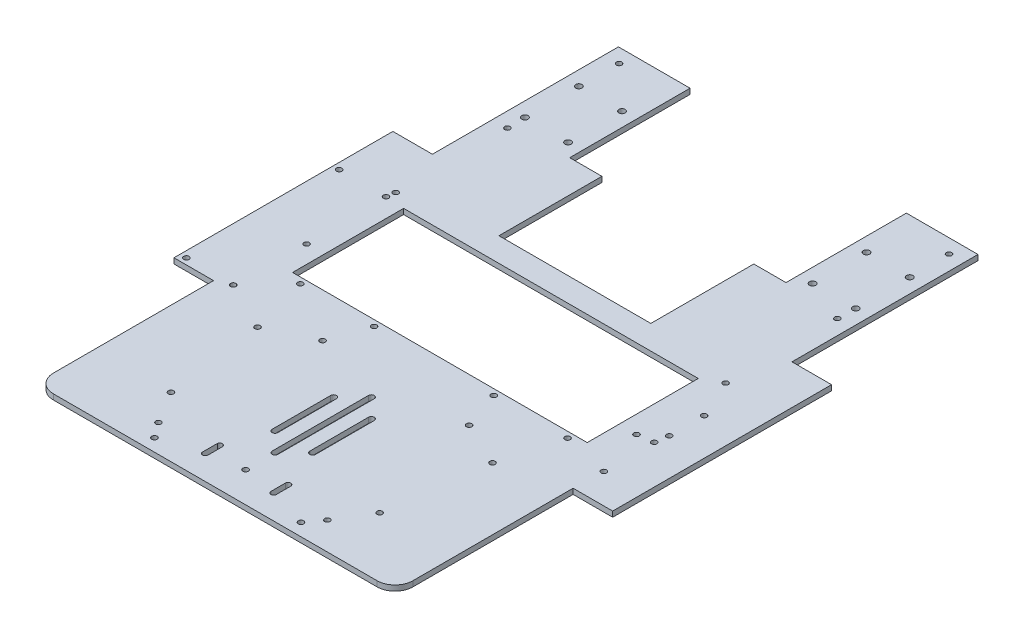
from build123d import *

# Parameters (mm, degrees)
SKETCH_1_W           = 200
SKETCH_1_H           = 375
EXTRUDE_1_DEPTH      = 3
SKETCH_2_R           = 1.75
CUT_EXTRUDE_1_DEPTH  = 10
SKETCH_3_R           = 1.5
CUT_EXTRUDE_2_DEPTH  = 10
SKETCH_4_R           = 1.5
CUT_EXTRUDE_3_DEPTH  = 10
SKETCH_5_W           = 210
SKETCH_5_H           = 50.72585274
CUT_EXTRUDE_5_DEPTH  = 34.39
SKETCH_8_R           = 1.5
EXTRUDE_2_DEPTH      = 3
SKETCH_9_W           = 163.883016164
SKETCH_9_H           = 75
CUT_EXTRUDE_6_DEPTH  = 10
CUT_EXTRUDE_7_DEPTH  = 3
SKETCH_11_R          = 1.5
CUT_EXTRUDE_8_DEPTH  = 6
SKETCH_12_R          = 1.5
CUT_EXTRUDE_9_DEPTH  = 3
CUT_EXTRUDE_10_DEPTH = 163.8
SKETCH_16_W          = 173.87129554
SKETCH_16_H          = 50.701400684
EXTRUDE_4_DEPTH      = 3
SKETCH_18_W          = 121.748470969
SKETCH_18_H          = 3
EXTRUDE_5_DEPTH      = 22
SKETCH_19_W          = 17.27862471
SKETCH_19_H          = 21.556396233
CUT_EXTRUDE_11_DEPTH = 22
SKETCH_20_R          = 1.5
CUT_EXTRUDE_12_DEPTH = 5
SKETCH_21_R          = 1.5
CUT_EXTRUDE_13_DEPTH = 6
SKETCH_22_W          = 163.883016164
SKETCH_22_H          = 4.895548477
EXTRUDE_6_DEPTH      = 3
CUT_EXTRUDE_14_DEPTH = 10
CUT_EXTRUDE_15_DEPTH = 10
SKETCH_25_R          = 1.5
CUT_EXTRUDE_16_DEPTH = 5
SKETCH_26_R          = 1.5
CUT_EXTRUDE_17_DEPTH = 10
SKETCH_27_R          = 1.5
CUT_EXTRUDE_18_DEPTH = 3
SKETCH_28_R          = 1.5
CUT_EXTRUDE_19_DEPTH = 3
FILLET_1_R           = 10


with BuildPart() as part:
    # 草图1 → 凸台-拉伸1 (new body)
    with BuildSketch(Plane(origin=(0, 0, 0), x_dir=(1, 0, 0), z_dir=(0, 1, 0))):
        Rectangle(SKETCH_1_W, SKETCH_1_H)
    extrude(amount=EXTRUDE_1_DEPTH)

    # 草图2 → 切除-拉伸1 (cut)
    with BuildSketch(Plane.XZ):
        with Locations(Location((-68, -157.5, 0), (0, 0, 270))):
            Circle(SKETCH_2_R)
        with Locations(Location((-92, -157.5, 0), (0, 0, 270))):
            Circle(SKETCH_2_R)
        with Locations(Location((-92, -127.5, 0), (0, 0, 270))):
            Circle(SKETCH_2_R)
        with Locations(Location((-68, -127.5, 0), (0, 0, 270))):
            Circle(SKETCH_2_R)
        with Locations(Location((68, -157.5, 0), (0, 0, 270))):
            Circle(SKETCH_2_R)
        with Locations(Location((92, -157.5, 0), (0, 0, 270))):
            Circle(SKETCH_2_R)
        with Locations(Location((92, -127.5, 0), (0, 0, 270))):
            Circle(SKETCH_2_R)
        with Locations(Location((68, -127.5, 0), (0, 0, 270))):
            Circle(SKETCH_2_R)
    extrude(amount=-CUT_EXTRUDE_1_DEPTH, mode=Mode.SUBTRACT)

    # 草图3 → 切除-拉伸2 (cut)
    with BuildSketch(Plane(origin=(0, 3, 0), x_dir=(1, 0, 0), z_dir=(0, 1, 0))):
        with Locations(Location((0, -119.896683452, 0), (0, 0, 270))):
            Circle(SKETCH_3_R)
    extrude(amount=-CUT_EXTRUDE_2_DEPTH, mode=Mode.SUBTRACT)

    # 草图4 → 切除-拉伸3 (cut)
    with BuildSketch(Plane(origin=(0, 3, 0), x_dir=(1, 0, 0), z_dir=(0, 1, 0))):
        with Locations(Location((19, -119.896683452, 0), (0, 0, 270))):
            Circle(SKETCH_4_R)
        with Locations(Location((-19, -119.896683452, 0), (0, 0, 270))):
            Circle(SKETCH_4_R)
    extrude(amount=-CUT_EXTRUDE_3_DEPTH, mode=Mode.SUBTRACT)

    # 草图5 → 切除-拉伸5 (cut)
    with BuildSketch(Plane.XZ):
        with Locations((0, 162.13707363)):
            Rectangle(SKETCH_5_W, SKETCH_5_H)
    extrude(amount=-CUT_EXTRUDE_5_DEPTH, mode=Mode.SUBTRACT)

    # 草图8 → 凸台-拉伸2 (add)
    with BuildSketch(Plane.ZY.offset(100)):
        with BuildLine():
            Line((34.419687156, 14.367900616), (37.872189, 3))
            Line((37.872189, 3), (25.226116951, 3))
            Line((25.226116951, 3), (28.678618796, 14.367900616))
            ThreePointArc((28.678618796, 14.367900616), (31.549152976, 16.496101602), (34.419687156, 14.367900616))
        make_face()
        with Locations((31.549152976, 13.496101602)):
            Circle(SKETCH_8_R, mode=Mode.SUBTRACT)
    extrude(amount=-EXTRUDE_2_DEPTH)

    # 草图9 → 切除-拉伸6 (cut)
    with BuildSketch(Plane.XZ):
        with Locations((0, 18.152093794)):
            Rectangle(SKETCH_9_W, SKETCH_9_H)
    extrude(amount=-CUT_EXTRUDE_6_DEPTH, mode=Mode.SUBTRACT)

    # 草图10 → 切除-拉伸7 (cut)
    with BuildSketch(Plane.XZ):
        Polygon((-60.157077223, -120.5533384), (-42.238826625, -120.5533384), (-42.238826625, -63.289088645), (42.238826625, -63.289088645), (42.238826625, -120.5533384), (60.157077223, -120.5533384), (60.157077223, -187.5), (-60.157077223, -187.5), align=None)
    extrude(amount=-CUT_EXTRUDE_7_DEPTH, mode=Mode.SUBTRACT)

    # 草图11 → 切除-拉伸8 (cut)
    with BuildSketch(Plane(origin=(0, 3, 0), x_dir=(1, 0, 0), z_dir=(0, 1, 0))):
        with Locations(Location((-91.756220162, 179.630143817, 0), (0, 0, 270))):
            Circle(SKETCH_11_R)
        with Locations(Location((-91.756220162, 117.5, 0), (0, 0, 270))):
            Circle(SKETCH_11_R)
        with Locations(Location((-91.756220162, 55.369856183, 0), (0, 0, 270))):
            Circle(SKETCH_11_R)
        with Locations(Location((91.756220162, 55.369856183, 0), (0, 0, 270))):
            Circle(SKETCH_11_R)
        with Locations(Location((91.756220162, 117.5, 0), (0, 0, 270))):
            Circle(SKETCH_11_R)
        with Locations(Location((91.756220162, 179.630143817, 0), (0, 0, 270))):
            Circle(SKETCH_11_R)
    extrude(amount=-CUT_EXTRUDE_8_DEPTH, mode=Mode.SUBTRACT)

    # 草图12 → 切除-拉伸9 (cut)
    with BuildSketch(Plane(origin=(0, 3, 0), x_dir=(1, 0, 0), z_dir=(0, 1, 0))):
        with Locations(Location((-91.756220162, 5.808361465, 0), (0, 0, 270))):
            Circle(SKETCH_12_R)
        with Locations(Location((91.756220162, 5.808361465, 0), (0, 0, 270))):
            Circle(SKETCH_12_R)
    extrude(amount=-CUT_EXTRUDE_9_DEPTH, mode=Mode.SUBTRACT)

    # 草图14 → 切除-拉伸10 (cut)
    with BuildSketch(Plane(origin=(0, 3, 0), x_dir=(1, 0, 0), z_dir=(0, 1, 0))):
        Polygon((81.941508082, 19.347906206), (81.941508082, 49.288971574), (81.941508082, 54.851401937), (-81.941508082, 54.851401937), (-81.941508082, 49.288971574), (-81.941508082, 19.347906206), align=None)
    extrude(amount=-CUT_EXTRUDE_10_DEPTH, mode=Mode.SUBTRACT)

    # 草图16 → 凸台-拉伸4 (add)
    with BuildSketch(Plane(origin=(0, 3, 0), x_dir=(1, 0, 0), z_dir=(0, 1, 0))):
        with Locations((0.567640728, -37.155553542)):
            Rectangle(SKETCH_16_W, SKETCH_16_H)
    extrude(amount=-EXTRUDE_4_DEPTH)

    # 草图18 → 凸台-拉伸5 (add)
    with BuildSketch(Plane.ZY.offset(100)):
        with Locations((-23.168262452, 1.5)):
            Rectangle(SKETCH_18_W, SKETCH_18_H)
    extrude_5 = extrude(amount=EXTRUDE_5_DEPTH)

    # 草图19 → 切除-拉伸11 (cut)
    with BuildSketch(Plane.ZY.offset(100)):
        with Locations((31.606580178, 13.778198117)):
            Rectangle(SKETCH_19_W, SKETCH_19_H)
    extrude(amount=-CUT_EXTRUDE_11_DEPTH, mode=Mode.SUBTRACT)

    # 镜向1: 凸台-拉伸5 across plane
    add(extrude_5.mirror(Plane(origin=(0, 0, 0), x_dir=(0, 0, 1), z_dir=(1, 0, 0))))

    # 草图20 → 切除-拉伸12 (cut)
    with BuildSketch(Plane.XZ):
        with Locations(Location((-92.437313721, 34.301588012, 0), (0, 0, 270))):
            Circle(SKETCH_20_R)
        with Locations(Location((-118.512686279, 34.301588012, 0), (0, 0, 270))):
            Circle(SKETCH_20_R)
        with Locations(Location((-92.437313721, -50.669641947, 0), (0, 0, 270))):
            Circle(SKETCH_20_R)
        with Locations(Location((-118.512686279, -50.669641947, 0), (0, 0, 270))):
            Circle(SKETCH_20_R)
    extrude(amount=-CUT_EXTRUDE_12_DEPTH, mode=Mode.SUBTRACT)

    # 草图21 → 切除-拉伸13 (cut)
    with BuildSketch(Plane(origin=(0, 3, 0), x_dir=(1, 0, 0), z_dir=(0, 1, 0))):
        with Locations(Location((101.493568208, 33.673307051, 0), (0, 0, 270))):
            Circle(SKETCH_21_R)
        with Locations(Location((101.493568208, 14.236029002, 0), (0, 0, 270))):
            Circle(SKETCH_21_R)
        with Locations(Location((100.46791463, -21.089263072, 0), (0, 0, 270))):
            Circle(SKETCH_21_R)
        with Locations(Location((100.46791463, 6.938433331, 0), (0, 0, 270))):
            Circle(SKETCH_21_R)
    extrude(amount=-CUT_EXTRUDE_13_DEPTH, mode=Mode.SUBTRACT)

    # 草图22 → 凸台-拉伸6 (add)
    with BuildSketch(Plane(origin=(0, 3, 0), x_dir=(1, 0, 0), z_dir=(0, 1, 0))):
        with Locations((0, 52.403627699)):
            Rectangle(SKETCH_22_W, SKETCH_22_H)
    extrude(amount=-EXTRUDE_6_DEPTH)

    # 草图23 → 切除-拉伸14 (cut)
    with BuildSketch(Plane.XZ):
        with BuildLine():
            Line((-12.1, 93.046379783), (-12.1, 60.426325499))
            ThreePointArc((-12.1, 60.426325499), (-10.5, 58.826325499), (-8.9, 60.426325499))
            Line((-8.9, 60.426325499), (-8.9, 93.046379783))
            ThreePointArc((-8.9, 93.046379783), (-10.5, 94.646379783), (-12.1, 93.046379783))
        make_face()
        with BuildLine():
            Line((8.9, 93.046379783), (8.9, 60.426325499))
            ThreePointArc((8.9, 60.426325499), (10.5, 58.826325499), (12.1, 60.426325499))
            Line((12.1, 60.426325499), (12.1, 93.046379783))
            ThreePointArc((12.1, 93.046379783), (10.5, 94.646379783), (8.9, 93.046379783))
        make_face()
        with BuildLine():
            Line((-1.6, 103.546379783), (-1.6, 49.926325499))
            ThreePointArc((-1.6, 49.926325499), (0, 48.326325499), (1.6, 49.926325499))
            Line((1.6, 49.926325499), (1.6, 103.546379783))
            ThreePointArc((1.6, 103.546379783), (0, 105.146379783), (-1.6, 103.546379783))
        make_face()
    extrude(amount=-CUT_EXTRUDE_14_DEPTH, mode=Mode.SUBTRACT)

    # 草图24 → 切除-拉伸15 (cut)
    with BuildSketch(Plane(origin=(0, 3, 0), x_dir=(1, 0, 0), z_dir=(0, 1, 0))):
        with BuildLine():
            Line((-20.5, -115.409589276), (-20.5, -119.896683452))
            Line((-20.5, -119.896683452), (-20.5, -123.292696741))
            ThreePointArc((-20.5, -123.292696741), (-19, -124.792696741), (-17.5, -123.292696741))
            Line((-17.5, -123.292696741), (-17.5, -119.896683452))
            Line((-17.5, -119.896683452), (-17.5, -115.409589276))
            Line((-17.5, -115.409589276), (-17.5, -115.10448085))
            ThreePointArc((-17.5, -115.10448085), (-19, -113.749297424), (-20.5, -115.10448085))
            Line((-20.5, -115.10448085), (-20.5, -115.409589276))
        make_face()
        with BuildLine():
            ThreePointArc((17.5, -123.292696741), (19, -124.792696741), (20.5, -123.292696741))
            Line((20.5, -123.292696741), (20.5, -119.896683452))
            Line((20.5, -119.896683452), (20.5, -115.409589276))
            Line((20.5, -115.409589276), (20.5, -115.10448085))
            ThreePointArc((20.5, -115.10448085), (19, -113.749297424), (17.5, -115.10448085))
            Line((17.5, -115.10448085), (17.5, -115.409589276))
            Line((17.5, -115.409589276), (17.5, -119.896683452))
            Line((17.5, -119.896683452), (17.5, -123.292696741))
        make_face()
    extrude(amount=-CUT_EXTRUDE_15_DEPTH, mode=Mode.SUBTRACT)

    # 草图25 → 切除-拉伸16 (cut)
    with BuildSketch(Plane(origin=(0, 3, 0), x_dir=(1, 0, 0), z_dir=(0, 1, 0))):
        with Locations(Location((-74.307985478, -15.126608199, 0), (0, 0, 270))):
            Circle(SKETCH_25_R)
        with Locations(Location((-33.249974851, -15.126608199, 0), (0, 0, 270))):
            Circle(SKETCH_25_R)
        with Locations(Location((33.249974851, -15.126608199, 0), (0, 0, 270))):
            Circle(SKETCH_25_R)
        with Locations(Location((74.307985478, -15.126608199, 0), (0, 0, 270))):
            Circle(SKETCH_25_R)
    extrude(amount=-CUT_EXTRUDE_16_DEPTH, mode=Mode.SUBTRACT)

    # 草图26 → 切除-拉伸17 (cut)
    with BuildSketch(Plane(origin=(0, 3, 0), x_dir=(1, 0, 0), z_dir=(0, 1, 0))):
        with Locations(Location((-65.342005187, -47.889665829, 0), (0, 0, 270))):
            Circle(SKETCH_26_R)
        with Locations(Location((65.342005187, -47.889665829, 0), (0, 0, 270))):
            Circle(SKETCH_26_R)
        with Locations(Location((46.986453842, -121.386909585, 0), (0, 0, 270))):
            Circle(SKETCH_26_R)
        with Locations(Location((-46.986453842, -121.386909585, 0), (0, 0, 270))):
            Circle(SKETCH_26_R)
    extrude(amount=-CUT_EXTRUDE_17_DEPTH, mode=Mode.SUBTRACT)

    # 草图27 → 切除-拉伸18 (cut)
    with BuildSketch(Plane(origin=(0, 3, 0), x_dir=(1, 0, 0), z_dir=(0, 1, 0))):
        with Locations(Location((-40.75, -36.322032373, 0), (0, 0, 270))):
            Circle(SKETCH_27_R)
        with Locations(Location((40.75, -36.322032373, 0), (0, 0, 270))):
            Circle(SKETCH_27_R)
        with Locations(Location((40.75, -129.822032373, 0), (0, 0, 270))):
            Circle(SKETCH_27_R)
        with Locations(Location((-40.75, -129.822032373, 0), (0, 0, 270))):
            Circle(SKETCH_27_R)
    extrude(amount=-CUT_EXTRUDE_18_DEPTH, mode=Mode.SUBTRACT)

    # 草图28 → 切除-拉伸19 (cut)
    with BuildSketch(Plane(origin=(0, 3, 0), x_dir=(1, 0, 0), z_dir=(0, 1, 0))):
        with Locations(Location((-58.033655971, -103.347880676, 0), (0, 0, 270))):
            Circle(SKETCH_28_R)
        with Locations(Location((58.033655971, -103.347880676, 0), (0, 0, 270))):
            Circle(SKETCH_28_R)
    extrude(amount=-CUT_EXTRUDE_19_DEPTH, mode=Mode.SUBTRACT)

    # 圆角1
    fillet_1_edges = [part.edges().sort_by_distance(p)[0] for p in [
        (100, 1.5, 136.77414726),
        (-100, 1.5, 136.77414726),
    ]]
    fillet(fillet_1_edges, radius=FILLET_1_R)


solid = part.part
